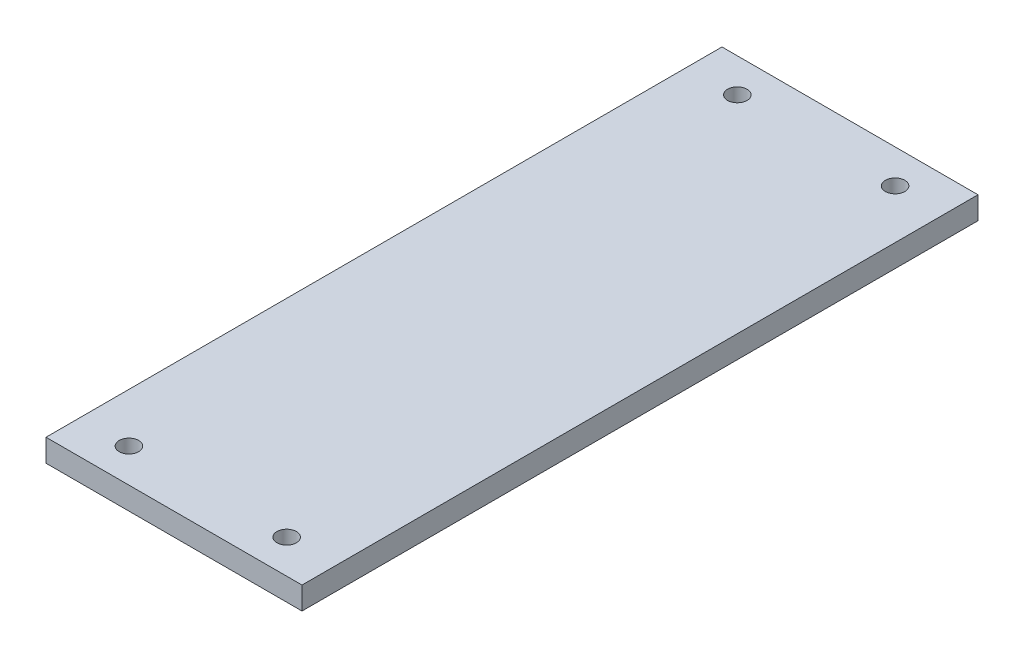
from build123d import *

# Parameters (mm, degrees)
SKETCH2_W           = 72.143718552
SKETCH2_H           = 190.5
BOSS_EXTRUDE1_DEPTH = 6.35
SKETCH3_R           = 2.75
CUT_EXTRUDE1_DEPTH  = 6.35


with BuildPart() as part:
    # Sketch2 → Boss-Extrude1 (new body)
    with BuildSketch(Plane(origin=(0, 0, 0), x_dir=(1, 0, 0), z_dir=(0, 1, 0))):
        Rectangle(SKETCH2_W, SKETCH2_H)
    extrude(amount=BOSS_EXTRUDE1_DEPTH)

    # Sketch3 → Cut-Extrude1 (cut)
    with BuildSketch(Plane(origin=(0, 6.35, 0), x_dir=(1, 0, 0), z_dir=(0, 1, 0))):
        with Locations(Location((-22.225, 85.725, 0), (0, 0, 270))):
            Circle(SKETCH3_R)
        with Locations(Location((22.225, 85.725, 0), (0, 0, 90))):
            Circle(SKETCH3_R)
        with Locations(Location((22.225, -85.725, 0), (0, 0, 270))):
            Circle(SKETCH3_R)
        with Locations(Location((-22.225, -85.725, 0), (0, 0, 90))):
            Circle(SKETCH3_R)
    extrude(amount=-CUT_EXTRUDE1_DEPTH, mode=Mode.SUBTRACT)


solid = part.part
